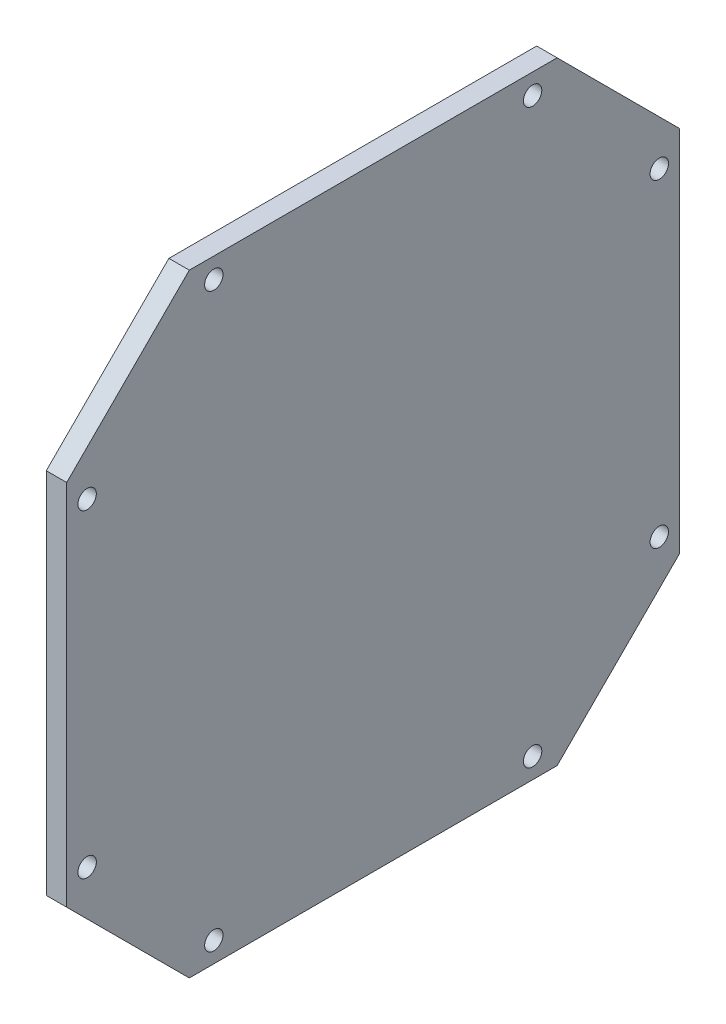
from build123d import *

# Parameters (mm, degrees)
SKETCH2_R           = 4.5
BOSS_EXTRUDE1_DEPTH = 10


with BuildPart() as part:
    # Sketch2 → Boss-Extrude1 (new body)
    with BuildSketch(Plane.YZ):
        Polygon((-150, 90), (-90, 150), (90, 150), (150, 90), (150, -90), (90, -150), (-90, -150), (-150, -90), align=None)
        with Locations(Location((-140, 78, 0), (0, 0, 270))):
            Circle(SKETCH2_R, mode=Mode.SUBTRACT)
        with Locations(Location((-78, 140, 0), (0, 0, 270))):
            Circle(SKETCH2_R, mode=Mode.SUBTRACT)
        with Locations(Location((-78, -140, 0), (0, 0, 90))):
            Circle(SKETCH2_R, mode=Mode.SUBTRACT)
        with Locations(Location((-140, -78, 0), (0, 0, 90))):
            Circle(SKETCH2_R, mode=Mode.SUBTRACT)
        with Locations(Location((78, -140, 0), (0, 0, 270))):
            Circle(SKETCH2_R, mode=Mode.SUBTRACT)
        with Locations(Location((140, -78, 0), (0, 0, 270))):
            Circle(SKETCH2_R, mode=Mode.SUBTRACT)
        with Locations(Location((140, 78, 0), (0, 0, 90))):
            Circle(SKETCH2_R, mode=Mode.SUBTRACT)
        with Locations(Location((78, 140, 0), (0, 0, 90))):
            Circle(SKETCH2_R, mode=Mode.SUBTRACT)
    extrude(amount=BOSS_EXTRUDE1_DEPTH)


solid = part.part
